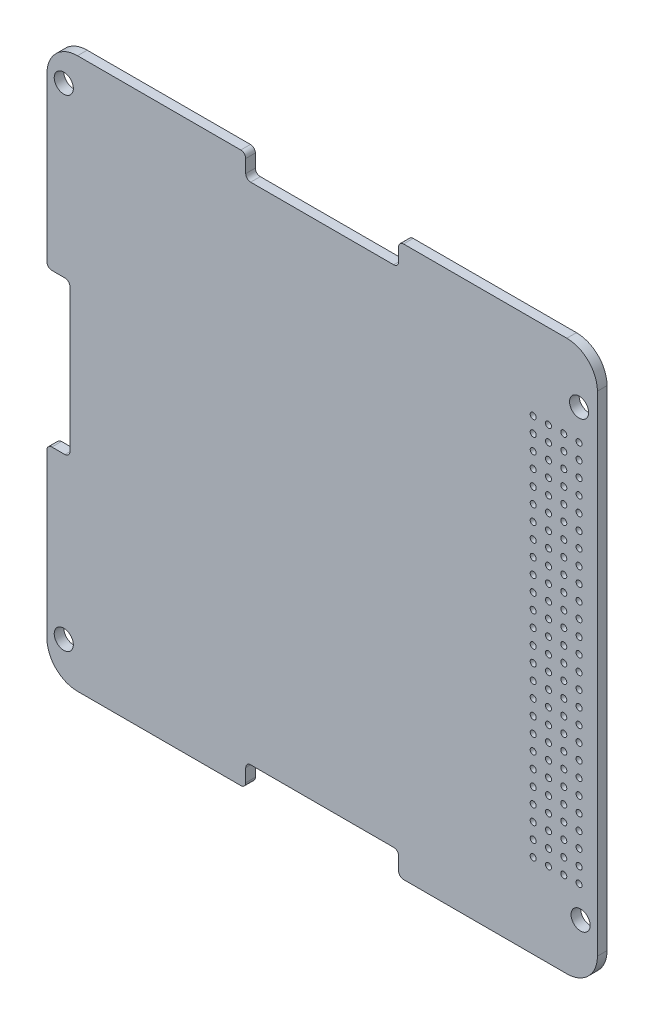
from build123d import *

# Parameters (mm, degrees)
SKETCH1_R           = 0.5
SKETCH1_R_2         = 1.5875
BOSS_EXTRUDE2_DEPTH = 1.6


with BuildPart() as part:
    # Sketch1 → Boss-Extrude2 (new body)
    with BuildSketch(Plane.XY):
        with BuildLine():
            Line((5.08, 0), (32.202420783, 0))
            ThreePointArc((32.202420783, 0), (32.780536591, 0.239463409), (33.02, 0.817579217))
            Line((33.02, 0.817579217), (33.02, 2.992420783))
            ThreePointArc((33.02, 2.992420783), (33.259463409, 3.570536591), (33.837579217, 3.81))
            Line((33.837579217, 3.81), (57.602420783, 3.81))
            ThreePointArc((57.602420783, 3.81), (58.180536591, 3.570536591), (58.42, 2.992420783))
            Line((58.42, 2.992420783), (58.42, 0.817579217))
            ThreePointArc((58.42, 0.817579217), (58.659463409, 0.239463409), (59.237579217, 0))
            Line((59.237579217, 0), (86.36, 0))
            ThreePointArc((86.36, 0), (89.952102448, 1.487897552), (91.44, 5.08))
            Line((91.44, 5.08), (91.44, 86.36))
            ThreePointArc((91.44, 86.36), (89.952102448, 89.952102448), (86.36, 91.44))
            Line((86.36, 91.44), (59.237579217, 91.44))
            ThreePointArc((59.237579217, 91.44), (58.659463409, 91.200536591), (58.42, 90.622420783))
            Line((58.42, 90.622420783), (58.42, 88.447579217))
            ThreePointArc((58.42, 88.447579217), (58.180536591, 87.869463409), (57.602420783, 87.63))
            Line((57.602420783, 87.63), (33.837579217, 87.63))
            ThreePointArc((33.837579217, 87.63), (33.259463409, 87.869463409), (33.02, 88.447579217))
            Line((33.02, 88.447579217), (33.02, 90.622420783))
            ThreePointArc((33.02, 90.622420783), (32.780536591, 91.200536591), (32.202420783, 91.44))
            Line((32.202420783, 91.44), (5.08, 91.44))
            ThreePointArc((5.08, 91.44), (1.487897552, 89.952102448), (0, 86.36))
            Line((0, 86.36), (0, 59.237579217))
            ThreePointArc((0, 59.237579217), (0.239463409, 58.659463409), (0.817579217, 58.42))
            Line((0.817579217, 58.42), (2.992420783, 58.42))
            ThreePointArc((2.992420783, 58.42), (3.570536591, 58.180536591), (3.81, 57.602420783))
            Line((3.81, 57.602420783), (3.81, 33.837579217))
            ThreePointArc((3.81, 33.837579217), (3.570536591, 33.259463409), (2.992420783, 33.02))
            Line((2.992420783, 33.02), (0.817579217, 33.02))
            ThreePointArc((0.817579217, 33.02), (0.239463409, 32.780536591), (0, 32.202420783))
            Line((0, 32.202420783), (0, 5.08))
            ThreePointArc((0, 5.08), (1.487897552, 1.487897552), (5.08, 0))
        make_face()
        with Locations((80.772, 77.47)):
            Circle(SKETCH1_R, mode=Mode.SUBTRACT)
        with Locations((83.312, 77.47)):
            Circle(SKETCH1_R, mode=Mode.SUBTRACT)
        with Locations((85.852, 77.47)):
            Circle(SKETCH1_R, mode=Mode.SUBTRACT)
        with Locations((88.392, 77.47)):
            Circle(SKETCH1_R, mode=Mode.SUBTRACT)
        with Locations((83.312, 74.93)):
            Circle(SKETCH1_R, mode=Mode.SUBTRACT)
        with Locations((85.852, 74.93)):
            Circle(SKETCH1_R, mode=Mode.SUBTRACT)
        with Locations((88.392, 74.93)):
            Circle(SKETCH1_R, mode=Mode.SUBTRACT)
        with Locations((83.312, 72.39)):
            Circle(SKETCH1_R, mode=Mode.SUBTRACT)
        with Locations((85.852, 72.39)):
            Circle(SKETCH1_R, mode=Mode.SUBTRACT)
        with Locations((88.392, 72.39)):
            Circle(SKETCH1_R, mode=Mode.SUBTRACT)
        with Locations((83.312, 69.85)):
            Circle(SKETCH1_R, mode=Mode.SUBTRACT)
        with Locations((85.852, 69.85)):
            Circle(SKETCH1_R, mode=Mode.SUBTRACT)
        with Locations((88.392, 69.85)):
            Circle(SKETCH1_R, mode=Mode.SUBTRACT)
        with Locations((83.312, 67.31)):
            Circle(SKETCH1_R, mode=Mode.SUBTRACT)
        with Locations((85.852, 67.31)):
            Circle(SKETCH1_R, mode=Mode.SUBTRACT)
        with Locations((88.392, 67.31)):
            Circle(SKETCH1_R, mode=Mode.SUBTRACT)
        with Locations((83.312, 64.77)):
            Circle(SKETCH1_R, mode=Mode.SUBTRACT)
        with Locations((85.852, 64.77)):
            Circle(SKETCH1_R, mode=Mode.SUBTRACT)
        with Locations((88.392, 64.77)):
            Circle(SKETCH1_R, mode=Mode.SUBTRACT)
        with Locations((83.312, 62.23)):
            Circle(SKETCH1_R, mode=Mode.SUBTRACT)
        with Locations((85.852, 62.23)):
            Circle(SKETCH1_R, mode=Mode.SUBTRACT)
        with Locations((88.392, 62.23)):
            Circle(SKETCH1_R, mode=Mode.SUBTRACT)
        with Locations((83.312, 59.69)):
            Circle(SKETCH1_R, mode=Mode.SUBTRACT)
        with Locations((85.852, 59.69)):
            Circle(SKETCH1_R, mode=Mode.SUBTRACT)
        with Locations((88.392, 59.69)):
            Circle(SKETCH1_R, mode=Mode.SUBTRACT)
        with Locations((83.312, 57.15)):
            Circle(SKETCH1_R, mode=Mode.SUBTRACT)
        with Locations((85.852, 57.15)):
            Circle(SKETCH1_R, mode=Mode.SUBTRACT)
        with Locations((88.392, 57.15)):
            Circle(SKETCH1_R, mode=Mode.SUBTRACT)
        with Locations((83.312, 54.61)):
            Circle(SKETCH1_R, mode=Mode.SUBTRACT)
        with Locations((85.852, 54.61)):
            Circle(SKETCH1_R, mode=Mode.SUBTRACT)
        with Locations((88.392, 54.61)):
            Circle(SKETCH1_R, mode=Mode.SUBTRACT)
        with Locations((83.312, 52.07)):
            Circle(SKETCH1_R, mode=Mode.SUBTRACT)
        with Locations((85.852, 52.07)):
            Circle(SKETCH1_R, mode=Mode.SUBTRACT)
        with Locations((88.392, 52.07)):
            Circle(SKETCH1_R, mode=Mode.SUBTRACT)
        with Locations((83.312, 49.53)):
            Circle(SKETCH1_R, mode=Mode.SUBTRACT)
        with Locations((85.852, 49.53)):
            Circle(SKETCH1_R, mode=Mode.SUBTRACT)
        with Locations((88.392, 49.53)):
            Circle(SKETCH1_R, mode=Mode.SUBTRACT)
        with Locations((83.312, 46.99)):
            Circle(SKETCH1_R, mode=Mode.SUBTRACT)
        with Locations((85.852, 46.99)):
            Circle(SKETCH1_R, mode=Mode.SUBTRACT)
        with Locations((88.392, 46.99)):
            Circle(SKETCH1_R, mode=Mode.SUBTRACT)
        with Locations((83.312, 44.45)):
            Circle(SKETCH1_R, mode=Mode.SUBTRACT)
        with Locations((85.852, 44.45)):
            Circle(SKETCH1_R, mode=Mode.SUBTRACT)
        with Locations((88.392, 44.45)):
            Circle(SKETCH1_R, mode=Mode.SUBTRACT)
        with Locations((83.312, 41.91)):
            Circle(SKETCH1_R, mode=Mode.SUBTRACT)
        with Locations((85.852, 41.91)):
            Circle(SKETCH1_R, mode=Mode.SUBTRACT)
        with Locations((88.392, 41.91)):
            Circle(SKETCH1_R, mode=Mode.SUBTRACT)
        with Locations((83.312, 39.37)):
            Circle(SKETCH1_R, mode=Mode.SUBTRACT)
        with Locations((85.852, 39.37)):
            Circle(SKETCH1_R, mode=Mode.SUBTRACT)
        with Locations((88.392, 39.37)):
            Circle(SKETCH1_R, mode=Mode.SUBTRACT)
        with Locations((83.312, 36.83)):
            Circle(SKETCH1_R, mode=Mode.SUBTRACT)
        with Locations((85.852, 36.83)):
            Circle(SKETCH1_R, mode=Mode.SUBTRACT)
        with Locations((88.392, 36.83)):
            Circle(SKETCH1_R, mode=Mode.SUBTRACT)
        with Locations((83.312, 34.29)):
            Circle(SKETCH1_R, mode=Mode.SUBTRACT)
        with Locations((85.852, 34.29)):
            Circle(SKETCH1_R, mode=Mode.SUBTRACT)
        with Locations((88.392, 34.29)):
            Circle(SKETCH1_R, mode=Mode.SUBTRACT)
        with Locations((83.312, 31.75)):
            Circle(SKETCH1_R, mode=Mode.SUBTRACT)
        with Locations((85.852, 31.75)):
            Circle(SKETCH1_R, mode=Mode.SUBTRACT)
        with Locations((88.392, 31.75)):
            Circle(SKETCH1_R, mode=Mode.SUBTRACT)
        with Locations((83.312, 29.21)):
            Circle(SKETCH1_R, mode=Mode.SUBTRACT)
        with Locations((85.852, 29.21)):
            Circle(SKETCH1_R, mode=Mode.SUBTRACT)
        with Locations((88.392, 29.21)):
            Circle(SKETCH1_R, mode=Mode.SUBTRACT)
        with Locations((83.312, 26.67)):
            Circle(SKETCH1_R, mode=Mode.SUBTRACT)
        with Locations((85.852, 26.67)):
            Circle(SKETCH1_R, mode=Mode.SUBTRACT)
        with Locations((88.392, 26.67)):
            Circle(SKETCH1_R, mode=Mode.SUBTRACT)
        with Locations((83.312, 24.13)):
            Circle(SKETCH1_R, mode=Mode.SUBTRACT)
        with Locations((85.852, 24.13)):
            Circle(SKETCH1_R, mode=Mode.SUBTRACT)
        with Locations((88.392, 24.13)):
            Circle(SKETCH1_R, mode=Mode.SUBTRACT)
        with Locations((83.312, 21.59)):
            Circle(SKETCH1_R, mode=Mode.SUBTRACT)
        with Locations((85.852, 21.59)):
            Circle(SKETCH1_R, mode=Mode.SUBTRACT)
        with Locations((88.392, 21.59)):
            Circle(SKETCH1_R, mode=Mode.SUBTRACT)
        with Locations((83.312, 19.05)):
            Circle(SKETCH1_R, mode=Mode.SUBTRACT)
        with Locations((85.852, 19.05)):
            Circle(SKETCH1_R, mode=Mode.SUBTRACT)
        with Locations((88.392, 19.05)):
            Circle(SKETCH1_R, mode=Mode.SUBTRACT)
        with Locations((83.312, 16.51)):
            Circle(SKETCH1_R, mode=Mode.SUBTRACT)
        with Locations((85.852, 16.51)):
            Circle(SKETCH1_R, mode=Mode.SUBTRACT)
        with Locations((88.392, 16.51)):
            Circle(SKETCH1_R, mode=Mode.SUBTRACT)
        with Locations((83.312, 13.97)):
            Circle(SKETCH1_R, mode=Mode.SUBTRACT)
        with Locations((85.852, 13.97)):
            Circle(SKETCH1_R, mode=Mode.SUBTRACT)
        with Locations((88.392, 13.97)):
            Circle(SKETCH1_R, mode=Mode.SUBTRACT)
        with Locations((80.772, 74.93)):
            Circle(SKETCH1_R, mode=Mode.SUBTRACT)
        with Locations((80.772, 72.39)):
            Circle(SKETCH1_R, mode=Mode.SUBTRACT)
        with Locations((80.772, 69.85)):
            Circle(SKETCH1_R, mode=Mode.SUBTRACT)
        with Locations((80.772, 67.31)):
            Circle(SKETCH1_R, mode=Mode.SUBTRACT)
        with Locations((80.772, 64.77)):
            Circle(SKETCH1_R, mode=Mode.SUBTRACT)
        with Locations((80.772, 62.23)):
            Circle(SKETCH1_R, mode=Mode.SUBTRACT)
        with Locations((80.772, 59.69)):
            Circle(SKETCH1_R, mode=Mode.SUBTRACT)
        with Locations((80.772, 57.15)):
            Circle(SKETCH1_R, mode=Mode.SUBTRACT)
        with Locations((80.772, 54.61)):
            Circle(SKETCH1_R, mode=Mode.SUBTRACT)
        with Locations((80.772, 52.07)):
            Circle(SKETCH1_R, mode=Mode.SUBTRACT)
        with Locations((80.772, 49.53)):
            Circle(SKETCH1_R, mode=Mode.SUBTRACT)
        with Locations((80.772, 46.99)):
            Circle(SKETCH1_R, mode=Mode.SUBTRACT)
        with Locations((80.772, 44.45)):
            Circle(SKETCH1_R, mode=Mode.SUBTRACT)
        with Locations((80.772, 41.91)):
            Circle(SKETCH1_R, mode=Mode.SUBTRACT)
        with Locations((80.772, 39.37)):
            Circle(SKETCH1_R, mode=Mode.SUBTRACT)
        with Locations((80.772, 36.83)):
            Circle(SKETCH1_R, mode=Mode.SUBTRACT)
        with Locations((80.772, 34.29)):
            Circle(SKETCH1_R, mode=Mode.SUBTRACT)
        with Locations((80.772, 31.75)):
            Circle(SKETCH1_R, mode=Mode.SUBTRACT)
        with Locations((80.772, 29.21)):
            Circle(SKETCH1_R, mode=Mode.SUBTRACT)
        with Locations((80.772, 26.67)):
            Circle(SKETCH1_R, mode=Mode.SUBTRACT)
        with Locations((80.772, 24.13)):
            Circle(SKETCH1_R, mode=Mode.SUBTRACT)
        with Locations((80.772, 21.59)):
            Circle(SKETCH1_R, mode=Mode.SUBTRACT)
        with Locations((80.772, 19.05)):
            Circle(SKETCH1_R, mode=Mode.SUBTRACT)
        with Locations((80.772, 16.51)):
            Circle(SKETCH1_R, mode=Mode.SUBTRACT)
        with Locations((80.772, 13.97)):
            Circle(SKETCH1_R, mode=Mode.SUBTRACT)
        with Locations((88.646, 8.89)):
            Circle(SKETCH1_R_2, mode=Mode.SUBTRACT)
        with Locations((88.392, 82.55)):
            Circle(SKETCH1_R_2, mode=Mode.SUBTRACT)
        with Locations((2.794, 6.35)):
            Circle(SKETCH1_R_2, mode=Mode.SUBTRACT)
        with Locations((2.794, 86.36)):
            Circle(SKETCH1_R_2, mode=Mode.SUBTRACT)
    extrude(amount=BOSS_EXTRUDE2_DEPTH)


solid = part.part
